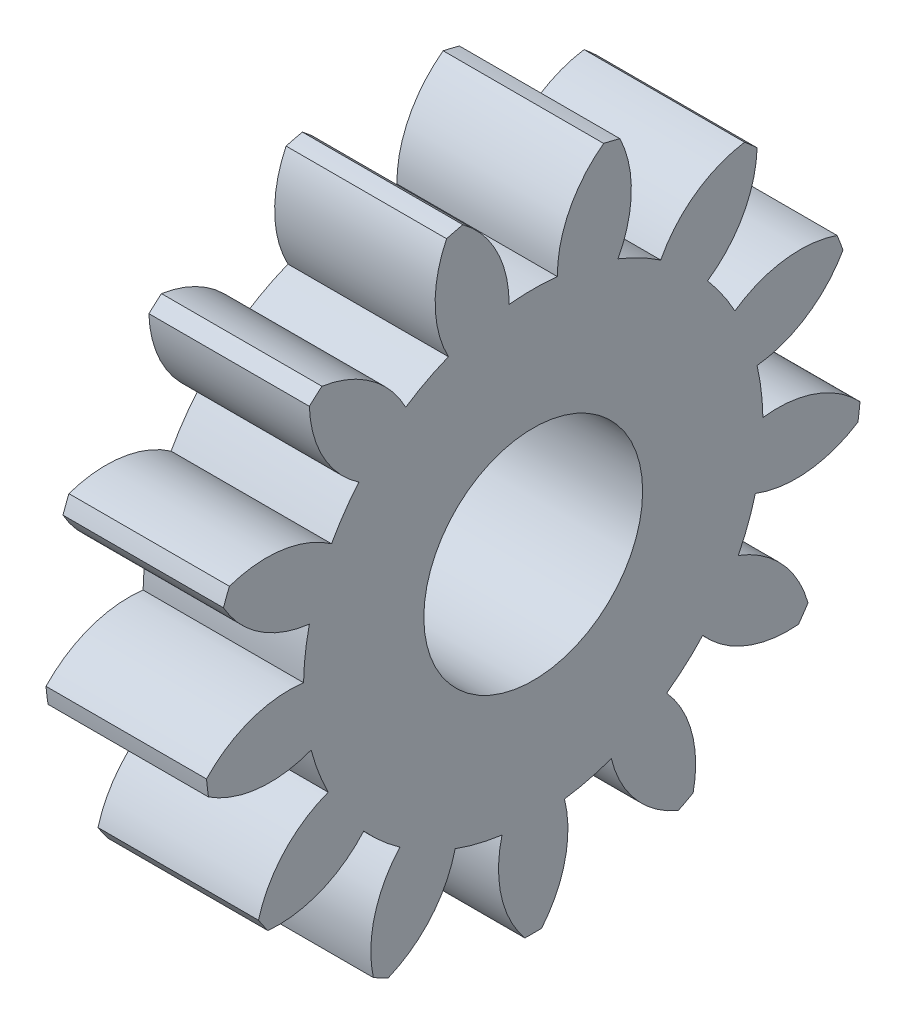
from build123d import *

# Parameters (mm, degrees)
BASPROSKE_W     = 2.2
BASPROSKE_H     = 4.5
TOOTHCUT_DEPTH  = 7.733498348
TEETHCUTS_COUNT = 13
TEETHCUTS_ANGLE = 332.307692308
BORSKE_R        = 1.5
BORE_DEPTH      = 50.0000508


with BuildPart() as part:
    # BasProSke → Base-Revolve (revolve)
    with BuildSketch(Plane(origin=(0, 0, 0), x_dir=(1, 0, 0), z_dir=(0, 1, 0)), mode=Mode.PRIVATE) as base_revolve_sk:
        with Locations((1.1, 2.25)):
            Rectangle(BASPROSKE_W, BASPROSKE_H)
    revolve(base_revolve_sk.sketch.rotate(Axis((-10, 0, 0), (1, 0, 0)), 180), axis=Axis((-10, 0, 0), (1, 0, 0)))

    # TooCutSke → ToothCut (cut, through all)
    with BuildSketch(Plane(origin=(0, 0, 0), x_dir=(0, 0, -1), z_dir=(1, 0, 0))):
        with BuildLine():
            ThreePointArc((0.330578579, 3.131600039), (0, 3.149), (-0.330578579, 3.131600039))
            ThreePointArc((-0.330578579, 3.131600039), (-0.504119116, 3.854627805), (-0.992642471, 4.415190379))
            ThreePointArc((-0.992642471, 4.415190379), (0, 4.5254), (0.992642471, 4.415190379))
            ThreePointArc((0.992642471, 4.415190379), (0.504119116, 3.854627805), (0.330578579, 3.131600039))
        make_face()
    toothcut = extrude(amount=TOOTHCUT_DEPTH, mode=Mode.SUBTRACT)

    # TeethCuts: ToothCut ×13 about axis
    teethcuts_axis = Axis((-10, 0, 0), (1, 0, 0))
    for i in range(1, TEETHCUTS_COUNT):
        add(toothcut.rotate(teethcuts_axis, i * TEETHCUTS_ANGLE / (TEETHCUTS_COUNT - 1)), mode=Mode.SUBTRACT)

    # BorSke → Bore (cut, symmetric)
    with BuildSketch(Plane(origin=(0, 0, 0), x_dir=(0, 0, -1), z_dir=(1, 0, 0))):
        with Locations(Location((0, 0, 0), (0, 0, 180))):
            Circle(BORSKE_R)
    extrude(amount=BORE_DEPTH, both=True, mode=Mode.SUBTRACT)


solid = part.part
